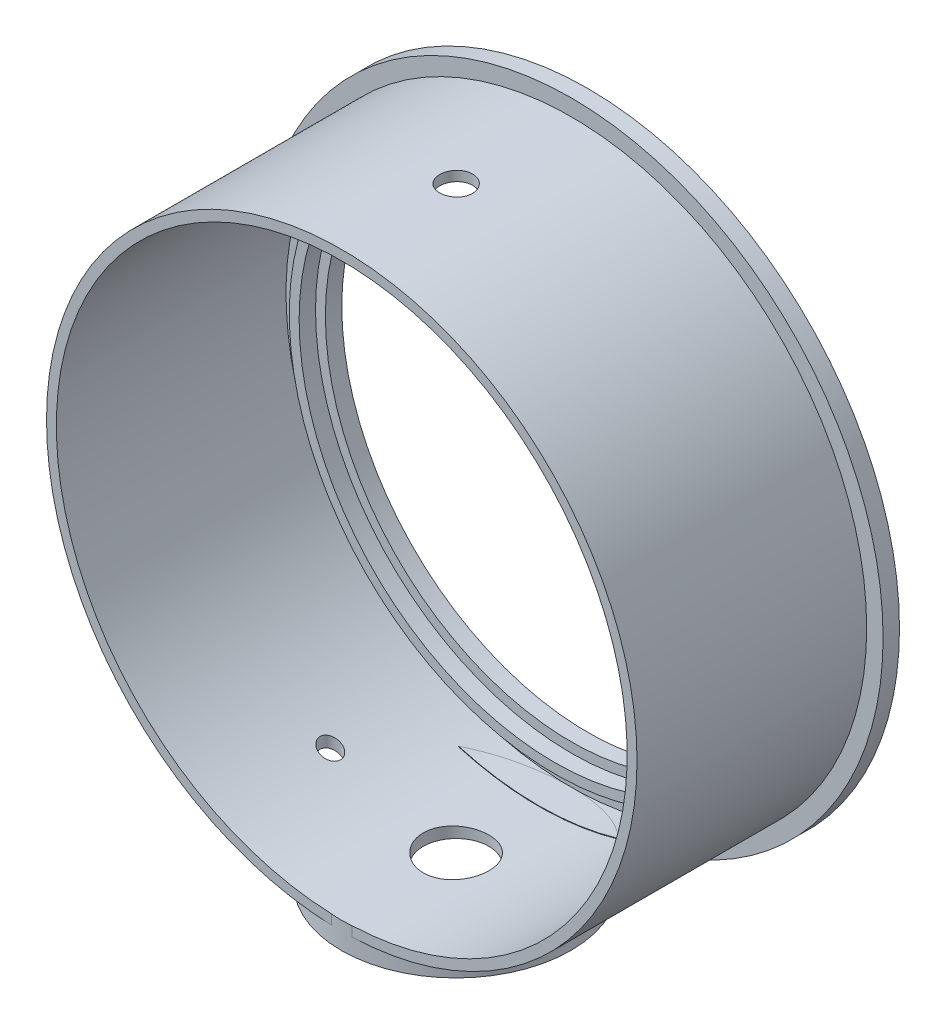
from build123d import *

# Parameters (mm, degrees)
SKETCH2_R           = 95
SKETCH2_R_2         = 75
BOSS_EXTRUDE1_DEPTH = 5
SKETCH3_R           = 90
SKETCH3_R_2         = 87
BOSS_EXTRUDE2_DEPTH = 75
SKETCH4_R           = 81
SKETCH4_R_2         = 78
BOSS_EXTRUDE4_DEPTH = 10
SKETCH6_R           = 35
BOSS_EXTRUDE5_DEPTH = 95
SKETCH7_R           = 75
CUT_EXTRUDE1_DEPTH  = 95
SKETCH8_R           = 87
CUT_EXTRUDE3_DEPTH  = 95
SKETCH9_R           = 86.82735855
CUT_EXTRUDE4_DEPTH  = 10
SKETCH10_R          = 81
SKETCH10_R_2        = 78
BOSS_EXTRUDE6_DEPTH = 10
SKETCH11_R          = 32
CUT_EXTRUDE5_DEPTH  = 5
SKETCH12_R          = 10
CUT_EXTRUDE6_DEPTH  = 5
SKETCH13_R          = 5
CUT_EXTRUDE7_DEPTH  = 185
SKETCH14_R          = 3.11609281
CUT_EXTRUDE9_DEPTH  = 185


with BuildPart() as part:
    # Sketch2 → Boss-Extrude1 (new body)
    with BuildSketch(Plane.XY):
        Circle(SKETCH2_R)
        Circle(SKETCH2_R_2, mode=Mode.SUBTRACT)
    extrude(amount=BOSS_EXTRUDE1_DEPTH)

    # Sketch3 → Boss-Extrude2 (add)
    with BuildSketch(Plane.XY):
        Circle(SKETCH3_R)
        Circle(SKETCH3_R_2, mode=Mode.SUBTRACT)
    extrude(amount=BOSS_EXTRUDE2_DEPTH)

    # Sketch4 → Boss-Extrude4 (add)
    with BuildSketch(Plane.XY):
        Circle(SKETCH4_R)
        Circle(SKETCH4_R_2, mode=Mode.SUBTRACT)
    extrude(amount=BOSS_EXTRUDE4_DEPTH)

    # Sketch6 → Boss-Extrude5 (add)
    with BuildSketch(Plane(origin=(0, 0, 0), x_dir=(1, 0, 0), z_dir=(0, 1, 0))):
        with Locations(Location((0, -40.143816704, 0), (0, 0, 270))):
            Circle(SKETCH6_R)
    extrude(amount=-BOSS_EXTRUDE5_DEPTH)

    # Sketch7 → Cut-Extrude1 (cut)
    with BuildSketch(Plane.XY):
        Circle(SKETCH7_R)
    extrude(amount=CUT_EXTRUDE1_DEPTH, mode=Mode.SUBTRACT)

    # Sketch8 → Cut-Extrude3 (cut)
    with BuildSketch(Plane.XY.offset(15)):
        with Locations(Location((0, 0, 0), (0, 0, 267.912115018))):
            Circle(SKETCH8_R)
    extrude(amount=CUT_EXTRUDE3_DEPTH, mode=Mode.SUBTRACT)

    # Sketch9 → Cut-Extrude4 (cut)
    with BuildSketch(Plane.XY.offset(15)):
        Circle(SKETCH9_R)
    extrude(amount=-CUT_EXTRUDE4_DEPTH, mode=Mode.SUBTRACT)

    # Sketch10 → Boss-Extrude6 (add)
    with BuildSketch(Plane.XY):
        Circle(SKETCH10_R)
        Circle(SKETCH10_R_2, mode=Mode.SUBTRACT)
    extrude(amount=BOSS_EXTRUDE6_DEPTH)

    # Sketch11 → Cut-Extrude5 (cut)
    with BuildSketch(Plane.XZ.offset(95)):
        with Locations(Location((0, 40.143816704, 0), (0, 0, 270))):
            Circle(SKETCH11_R)
    extrude(amount=-CUT_EXTRUDE5_DEPTH, mode=Mode.SUBTRACT)

    # Sketch12 → Cut-Extrude6 (cut)
    with BuildSketch(Plane.XZ.offset(90)):
        with Locations(Location((0, 40.143816704, 0), (0, 0, 270))):
            Circle(SKETCH12_R)
    extrude(amount=-CUT_EXTRUDE6_DEPTH, mode=Mode.SUBTRACT)

    # Sketch13 → Cut-Extrude7 (cut)
    with BuildSketch(Plane.XZ.offset(90)):
        with Locations(Location((0, 40.143816704, 0), (0, 0, 270))):
            Circle(SKETCH13_R)
    extrude(amount=-CUT_EXTRUDE7_DEPTH, mode=Mode.SUBTRACT)

    # Sketch14 → Cut-Extrude9 (cut)
    with BuildSketch(Plane(origin=(0, 0, 0), x_dir=(1, 0, 0), z_dir=(0, 1, 0))):
        with Locations(Location((-38.2, -40.29848956, 0), (0, 0, 270))):
            Circle(SKETCH14_R)
    extrude(amount=-CUT_EXTRUDE9_DEPTH, mode=Mode.SUBTRACT)


solid = part.part
